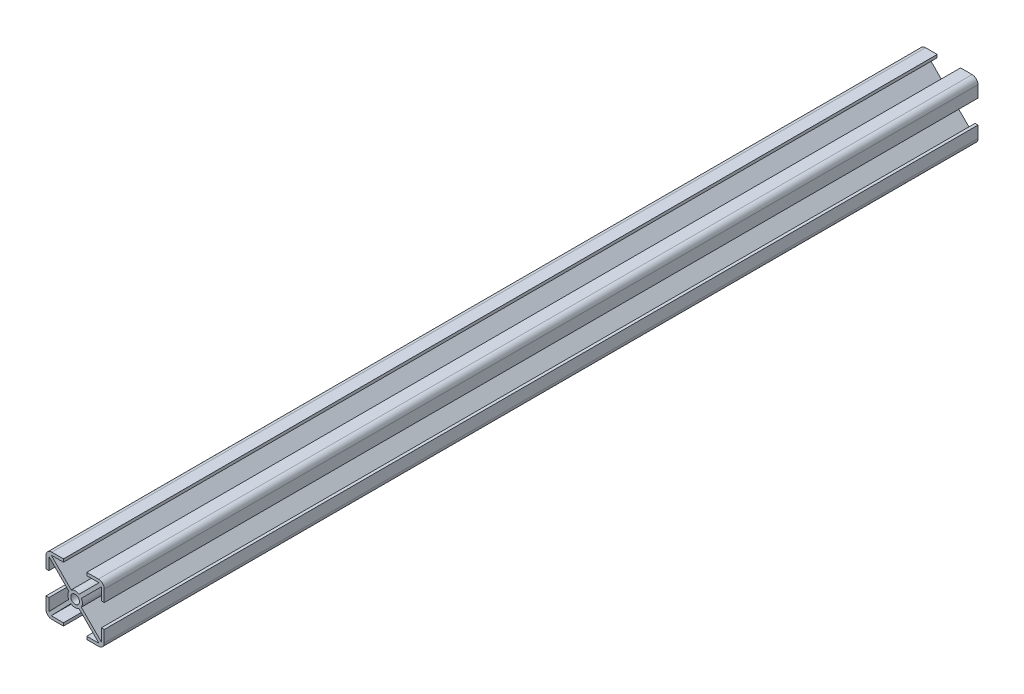
from build123d import *

# Parameters (mm, degrees)
ESQUISSE1_W             = 20
ESQUISSE1_H             = 20
ESQUISSE1_R             = 1.5
BOSS_EXTRU_1_DEPTH      = 300
CONG_1_R                = 2
ESQUISSE2_W             = 8
ESQUISSE2_H             = 1
ESQUISSE2_W_2           = 1
ESQUISSE2_H_2           = 8
ENL_V_MAT_EXTRU_1_DEPTH = 302.330383466


with BuildPart() as part:
    # Esquisse1 → Boss.-Extru.1 (new body)
    with BuildSketch(Plane.XY):
        with Locations((-10, 10)):
            Rectangle(ESQUISSE1_W, ESQUISSE1_H)
        with Locations((-10, 10)):
            Circle(ESQUISSE1_R, mode=Mode.SUBTRACT)
        with BuildLine():
            Line((-19, 18.2), (-12.144004756, 11.285785211))
            ThreePointArc((-12.144004756, 11.285785211), (-12.499292367, 10.059478285), (-12.20274135, 8.817658871))
            Line((-12.20274135, 8.817658871), (-19, 1.8))
            Line((-19, 1.8), (-19, 18.2))
        make_face(mode=Mode.SUBTRACT)
        with BuildLine():
            Line((-18.2, 1), (-1.8, 1))
            Line((-1.8, 1), (-8.678082464, 7.878082464))
            ThreePointArc((-8.678082464, 7.878082464), (-10.078866736, 7.501244302), (-11.453098741, 7.965668648))
            Line((-11.453098741, 7.965668648), (-18.2, 1))
        make_face(mode=Mode.SUBTRACT)
        with BuildLine():
            Line((-1, 18.2), (-1, 1.8))
            Line((-1, 1.8), (-7.878082464, 8.678082464))
            ThreePointArc((-7.878082464, 8.678082464), (-7.5, 10), (-7.878082464, 11.321917536))
            Line((-7.878082464, 11.321917536), (-1, 18.2))
        make_face(mode=Mode.SUBTRACT)
        with BuildLine():
            Line((-11.357461746, 12.099356475), (-18.2, 19))
            Line((-18.2, 19), (-1.8, 19))
            Line((-1.8, 19), (-8.678082464, 12.121917536))
            ThreePointArc((-8.678082464, 12.121917536), (-10.021049895, 12.499911379), (-11.357461746, 12.099356475))
        make_face(mode=Mode.SUBTRACT)
    extrude(amount=BOSS_EXTRU_1_DEPTH)

    # Congé1
    cong_1_edges = [part.edges().sort_by_distance(p)[0] for p in [
        (0, 0, 150),
        (-20, 0, 150),
        (-20, 20, 150),
        (0, 20, 150),
    ]]
    fillet(cong_1_edges, radius=CONG_1_R)

    # Esquisse2 → Enlèv. mat.-Extru.1 (cut, through all)
    with BuildSketch(Plane.XY.offset(300)):
        with Locations((-10, 19.5)):
            Rectangle(ESQUISSE2_W, ESQUISSE2_H)
        with Locations((-19.5, 10)):
            Rectangle(ESQUISSE2_W_2, ESQUISSE2_H_2)
        with Locations((-10, 0.5)):
            Rectangle(ESQUISSE2_W, ESQUISSE2_H)
        with Locations((-0.5, 10)):
            Rectangle(ESQUISSE2_W_2, ESQUISSE2_H_2)
    extrude(amount=-ENL_V_MAT_EXTRU_1_DEPTH, mode=Mode.SUBTRACT)


solid = part.part
